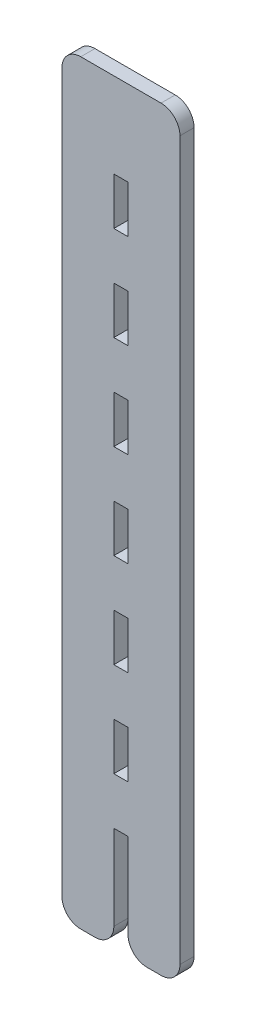
from build123d import *

# Parameters (mm, degrees)
ESQUISSE1_W        = 15
ESQUISSE1_H        = 50
BOSS_EXTRU_1_DEPTH = 15
CONG_1_R           = 20


with BuildPart() as part:
    # Esquisse1 → Boss.-Extru.1 (new body)
    with BuildSketch(Plane.XY):
        Polygon((0, 0), (55, 0), (55, 110), (70, 110), (70, 0), (125, 0), (125, 800), (0, 800), align=None)
        with Locations((62.5, 185)):
            Rectangle(ESQUISSE1_W, ESQUISSE1_H, mode=Mode.SUBTRACT)
        with Locations((62.5, 285)):
            Rectangle(ESQUISSE1_W, ESQUISSE1_H, mode=Mode.SUBTRACT)
        with Locations((62.5, 385)):
            Rectangle(ESQUISSE1_W, ESQUISSE1_H, mode=Mode.SUBTRACT)
        with Locations((62.5, 485)):
            Rectangle(ESQUISSE1_W, ESQUISSE1_H, mode=Mode.SUBTRACT)
        with Locations((62.5, 585)):
            Rectangle(ESQUISSE1_W, ESQUISSE1_H, mode=Mode.SUBTRACT)
        with Locations((62.5, 685)):
            Rectangle(ESQUISSE1_W, ESQUISSE1_H, mode=Mode.SUBTRACT)
    extrude(amount=BOSS_EXTRU_1_DEPTH)

    # Congé1
    cong_1_edges = [part.edges().sort_by_distance(p)[0] for p in [
        (0, 800, 7.5),
        (125, 800, 7.5),
        (125, 0, 7.5),
        (70, 0, 7.5),
        (55, 0, 7.5),
        (0, 0, 7.5),
    ]]
    fillet(cong_1_edges, radius=CONG_1_R)


solid = part.part
